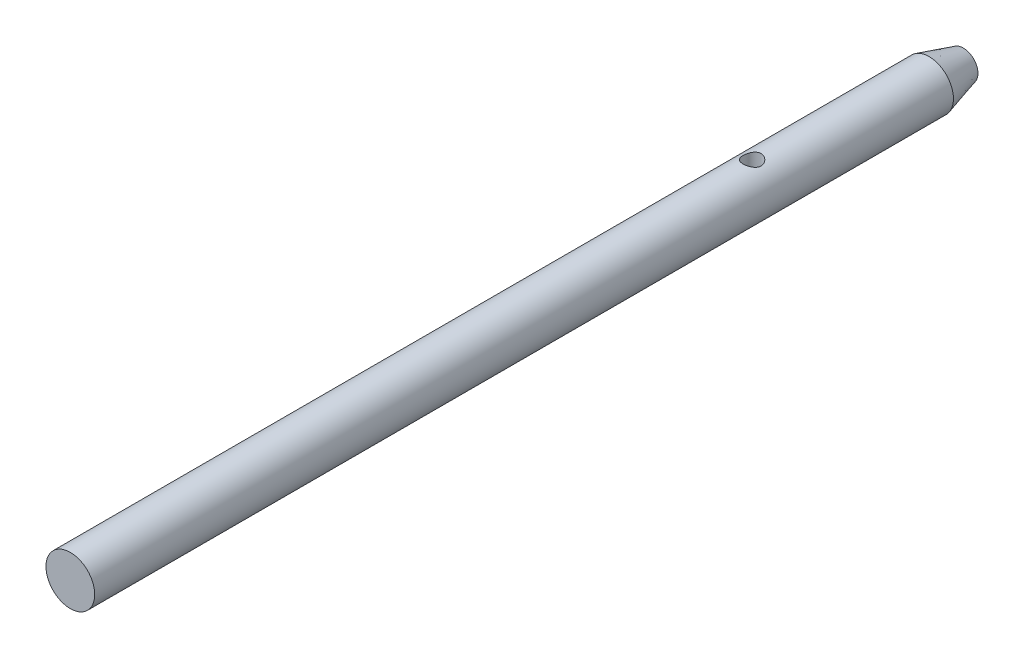
from build123d import *

# Parameters (mm, degrees)
SKETCH1_R                                   = 2.135
DRIVE_SHAFT_SHAPE_DEPTH                     = 78.2
DRIVE_SHAFT_CHAMFER_SIZE                    = 3
DRIVE_SHAFT_CHAMFER_SIZE2                   = 0.85
DRIVE_SHAFT_PIN_HOLE_REACH                  = 80.258
DRIVE_SHAFT_PIN_HOLE_END_RADIUS             = 2.135
SKETCH2_R                                   = 0.79
DRIVE_SHAFT_PIN_HOLE_DIRECTION_2_REACH      = 80.258
DRIVE_SHAFT_PIN_HOLE_DIRECTION_2_END_RADIUS = 2.135


with BuildPart() as part:
    # Sketch1 → drive shaft shape (new body)
    with BuildSketch(Plane.XY):
        Circle(SKETCH1_R)
    extrude(amount=DRIVE_SHAFT_SHAPE_DEPTH)

    # drive shaft chamfer
    drive_shaft_chamfer_edges = [part.edges().sort_by_distance(p)[0] for p in [
        (-2.135, 0, 0),
    ]]
    drive_shaft_chamfer_side = [part.faces().sort_by_distance(p)[0] for p in [
        (-2.135, 0, 39.1),
    ]]
    chamfer(drive_shaft_chamfer_edges, length=DRIVE_SHAFT_CHAMFER_SIZE, length2=DRIVE_SHAFT_CHAMFER_SIZE2, reference=drive_shaft_chamfer_side[0])

    # drive shaft pin hole: up to this cylinder (the profile starts inside it)
    drive_shaft_pin_hole_end = Plane(origin=(0, 0, 18.5), z_dir=(0, 0, -1)) * Cylinder(DRIVE_SHAFT_PIN_HOLE_END_RADIUS, 165.786, mode=Mode.PRIVATE)
    # Sketch2 → drive shaft pin hole (cut, up to the surface)
    with BuildSketch(Plane(origin=(0, 0, 0), x_dir=(1, 0, 0), z_dir=(0, 1, 0)), mode=Mode.PRIVATE) as drive_shaft_pin_hole_sk1:
        with Locations(Location((0, -18.5, 0), (0, 0, 270))):
            Circle(SKETCH2_R)
    drive_shaft_pin_hole_tool1 = extrude(drive_shaft_pin_hole_sk1.sketch, amount=-DRIVE_SHAFT_PIN_HOLE_REACH, mode=Mode.PRIVATE) & drive_shaft_pin_hole_end
    add(drive_shaft_pin_hole_tool1.solids().sort_by_distance((0, 0, 18.5))[0], mode=Mode.SUBTRACT)

    # drive shaft pin hole direction 2: up to this cylinder (the profile starts inside it)
    drive_shaft_pin_hole_direction_2_end = Plane(origin=(0, 0, 18.5), z_dir=(0, 0, -1)) * Cylinder(DRIVE_SHAFT_PIN_HOLE_DIRECTION_2_END_RADIUS, 165.786, mode=Mode.PRIVATE)
    # Sketch2 → drive shaft pin hole direction 2 (cut, up to the surface)
    with BuildSketch(Plane(origin=(0, 0, 0), x_dir=(1, 0, 0), z_dir=(0, 1, 0)), mode=Mode.PRIVATE) as drive_shaft_pin_hole_direction_2_sk1:
        with Locations(Location((0, -18.5, 0), (0, 0, 270))):
            Circle(SKETCH2_R)
    drive_shaft_pin_hole_direction_2_tool1 = extrude(drive_shaft_pin_hole_direction_2_sk1.sketch, amount=DRIVE_SHAFT_PIN_HOLE_DIRECTION_2_REACH, mode=Mode.PRIVATE) & drive_shaft_pin_hole_direction_2_end
    add(drive_shaft_pin_hole_direction_2_tool1.solids().sort_by_distance((0, 0, 18.5))[0], mode=Mode.SUBTRACT)


solid = part.part
